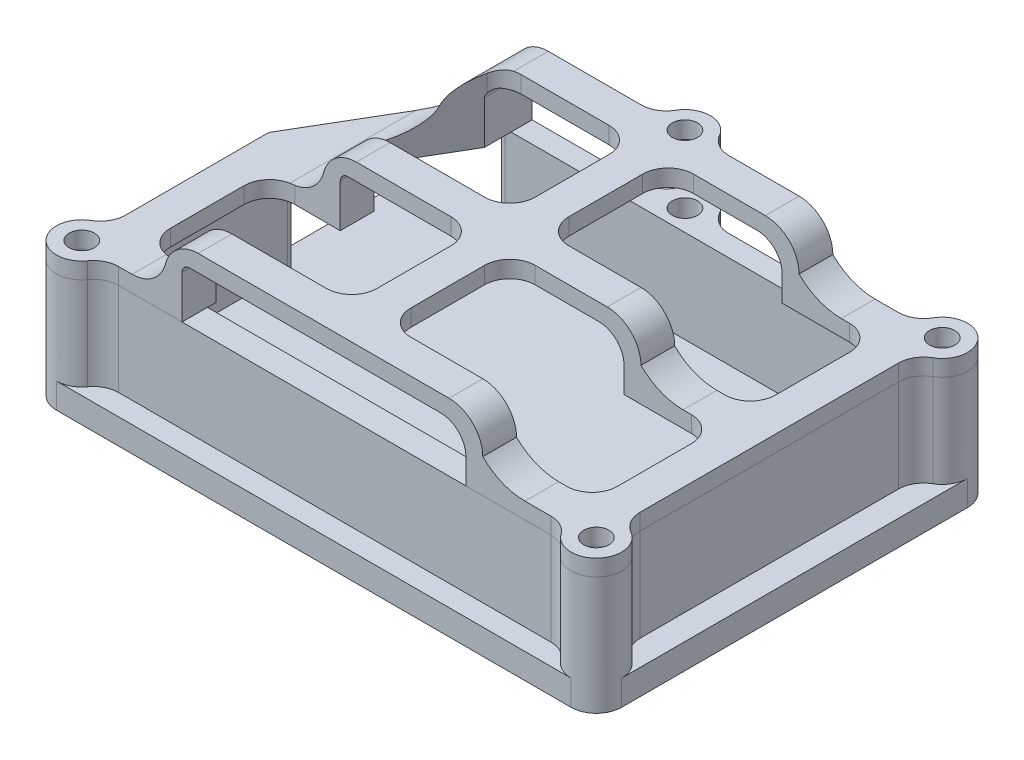
from build123d import *

# Parameters (mm, degrees)
SKETCH5_R           = 1.5
BOSS_EXTRUDE2_DEPTH = 3
SKETCH6_R           = 1.5
BOSS_EXTRUDE3_DEPTH = 11
SKETCH7_R           = 1.5
BOSS_EXTRUDE4_DEPTH = 8
CUT_EXTRUDE1_DEPTH  = 25


with BuildPart() as part:
    # Sketch5 → Boss-Extrude2 (new body)
    with BuildSketch(Plane(origin=(0, 0, 0), x_dir=(1, 0, 0), z_dir=(0, 1, 0))):
        with BuildLine():
            Line((-5.196152423, 20.5), (-27.5, 20.5))
            ThreePointArc((-27.5, 20.5), (-29.621320344, 19.621320344), (-30.5, 17.5))
            Line((-30.5, 17.5), (-30.5, -15.303847577))
            ThreePointArc((-30.5, -15.303847577), (-30.901923789, -16.803847577), (-32, -17.901923789))
            ThreePointArc((-32, -17.901923789), (-33.397777479, -21.276457135), (-30.5, -23.5))
            Line((-30.5, -23.5), (30.5, -23.5))
            ThreePointArc((30.5, -23.5), (32.621320344, -22.621320344), (33.5, -20.5))
            Line((33.5, -20.5), (33.5, 20.5))
            ThreePointArc((33.5, 20.5), (32.621320344, 22.621320344), (30.5, 23.5))
            Line((30.5, 23.5), (0, 23.5))
            ThreePointArc((0, 23.5), (-1.5, 23.098076211), (-2.598076211, 22))
            ThreePointArc((-2.598076211, 22), (-3.696152423, 20.901923789), (-5.196152423, 20.5))
        make_face()
        with Locations(Location((0, 20.5, 0), (0, 0, 270))):
            Circle(SKETCH5_R, mode=Mode.SUBTRACT)
        with Locations(Location((30.5, 20.5, 0), (0, 0, 270))):
            Circle(SKETCH5_R, mode=Mode.SUBTRACT)
        with Locations(Location((30.5, -20.5, 0), (0, 0, 270))):
            Circle(SKETCH5_R, mode=Mode.SUBTRACT)
        with Locations(Location((-30.5, -20.5, 0), (0, 0, 270))):
            Circle(SKETCH5_R, mode=Mode.SUBTRACT)
    extrude(amount=BOSS_EXTRUDE2_DEPTH)

    # Sketch6 → Boss-Extrude3 (add)
    with BuildSketch(Plane(origin=(0, 3, 0), x_dir=(1, 0, 0), z_dir=(0, 1, 0))):
        with BuildLine():
            Line((-30.5, 1.389438463), (-30.5, -15.303847577))
            ThreePointArc((-30.5, -15.303847577), (-30.901923789, -16.803847577), (-32, -17.901923789))
            ThreePointArc((-32, -17.901923789), (-32.723913835, -22.513506209), (-28.063301414, -22.25))
            ThreePointArc((-28.063301414, -22.25), (-26.995909221, -21.330730437), (-25.626602828, -21))
            Line((-25.626602828, -21), (25.626602828, -21))
            ThreePointArc((25.626602828, -21), (26.995909221, -21.330730437), (28.063301414, -22.25))
            ThreePointArc((28.063301414, -22.25), (32.723913835, -22.513506209), (32, -17.901923789))
            ThreePointArc((32, -17.901923789), (30.901923789, -16.803847577), (30.5, -15.303847577))
            Line((30.5, -15.303847577), (30.5, 15.303847577))
            ThreePointArc((30.5, 15.303847577), (30.901923789, 16.803847577), (32, 17.901923789))
            ThreePointArc((32, 17.901923789), (32.621320344, 22.621320344), (27.901923789, 22))
            ThreePointArc((27.901923789, 22), (26.803847577, 20.901923789), (25.303847577, 20.5))
            Line((25.303847577, 20.5), (5.196152423, 20.5))
            ThreePointArc((5.196152423, 20.5), (3.696152423, 20.901923789), (2.598076211, 22))
            ThreePointArc((2.598076211, 22), (0, 23.5), (-2.598076211, 22))
            ThreePointArc((-2.598076211, 22), (-3.696152423, 20.901923789), (-5.196152423, 20.5))
            Line((-5.196152423, 20.5), (-18.854157071, 20.5))
            ThreePointArc((-18.854157071, 20.5), (-19.561263852, 20.207106781), (-19.854157071, 19.5))
            Line((-19.854157071, 19.5), (-19.854157071, 19))
            ThreePointArc((-19.854157071, 19), (-19.561263852, 18.292893219), (-18.854157071, 18))
            Line((-18.854157071, 18), (26, 18))
            ThreePointArc((26, 18), (27.414213562, 17.414213562), (28, 16))
            Line((28, 16), (28, -16))
            ThreePointArc((28, -16), (27.414213562, -17.414213562), (26, -18))
            Line((26, -18), (-26, -18))
            ThreePointArc((-26, -18), (-27.414213562, -17.414213562), (-28, -16))
            Line((-28, -16), (-28, 1.389438463))
            ThreePointArc((-28, 1.389438463), (-28.292893219, 2.096545244), (-29, 2.389438463))
            Line((-29, 2.389438463), (-29.5, 2.389438463))
            ThreePointArc((-29.5, 2.389438463), (-30.207106781, 2.096545244), (-30.5, 1.389438463))
        make_face()
        with Locations(Location((0, 20.5, 0), (0, 0, 270))):
            Circle(SKETCH6_R, mode=Mode.SUBTRACT)
        with Locations(Location((30.5, 20.5, 0), (0, 0, 270))):
            Circle(SKETCH6_R, mode=Mode.SUBTRACT)
        with Locations(Location((30.5, -20.5, 0), (0, 0, 270))):
            Circle(SKETCH6_R, mode=Mode.SUBTRACT)
        with Locations(Location((-30.5, -20.5, 0), (0, 0, 270))):
            Circle(SKETCH6_R, mode=Mode.SUBTRACT)
    extrude(amount=BOSS_EXTRUDE3_DEPTH)


with BuildPart() as body_2:
    # Sketch7 → Boss-Extrude4 (new body)
    with BuildSketch(Plane(origin=(0, 14, 0), x_dir=(1, 0, 0), z_dir=(0, 1, 0))):
        with BuildLine():
            Line((-30.362088709, 1.896195858), (-19.71624578, 20.006757395))
            ThreePointArc((-19.71624578, 20.006757395), (-19.35076688, 20.367973904), (-18.854157071, 20.5))
            Line((-18.854157071, 20.5), (-5.196152423, 20.5))
            ThreePointArc((-5.196152423, 20.5), (-3.696152423, 20.901923789), (-2.598076211, 22))
            ThreePointArc((-2.598076211, 22), (0, 23.5), (2.598076211, 22))
            ThreePointArc((2.598076211, 22), (3.696152423, 20.901923789), (5.196152423, 20.5))
            Line((5.196152423, 20.5), (25.303847577, 20.5))
            ThreePointArc((25.303847577, 20.5), (26.803847577, 20.901923789), (27.901923789, 22))
            ThreePointArc((27.901923789, 22), (32.621320344, 22.621320344), (32, 17.901923789))
            ThreePointArc((32, 17.901923789), (30.901923789, 16.803847577), (30.5, 15.303847577))
            Line((30.5, 15.303847577), (30.5, -15.303847577))
            ThreePointArc((30.5, -15.303847577), (30.901923789, -16.803847577), (32, -17.901923789))
            ThreePointArc((32, -17.901923789), (32.723913835, -22.513506209), (28.063301414, -22.25))
            ThreePointArc((28.063301414, -22.25), (26.995909221, -21.330730437), (25.626602828, -21))
            Line((25.626602828, -21), (-25.626602828, -21))
            ThreePointArc((-25.626602828, -21), (-26.995909221, -21.330730437), (-28.063301414, -22.25))
            ThreePointArc((-28.063301414, -22.25), (-32.723913835, -22.513506209), (-32, -17.901923789))
            ThreePointArc((-32, -17.901923789), (-30.901923789, -16.803847577), (-30.5, -15.303847577))
            Line((-30.5, -15.303847577), (-30.5, 1.389438463))
            ThreePointArc((-30.5, 1.389438463), (-30.464906397, 1.652032532), (-30.362088709, 1.896195858))
        make_face()
        with Locations(Location((0, 20.5, 0), (0, 0, 270))):
            Circle(SKETCH7_R, mode=Mode.SUBTRACT)
        with Locations(Location((30.5, 20.5, 0), (0, 0, 270))):
            Circle(SKETCH7_R, mode=Mode.SUBTRACT)
        with Locations(Location((30.5, -20.5, 0), (0, 0, 270))):
            Circle(SKETCH7_R, mode=Mode.SUBTRACT)
        with Locations(Location((-30.5, -20.5, 0), (0, 0, 270))):
            Circle(SKETCH7_R, mode=Mode.SUBTRACT)
        with BuildLine():
            Line((-26.5, -14), (-26.5, -5.25))
            ThreePointArc((-26.5, -5.25), (-25.621320344, -3.128679656), (-23.5, -2.25))
            Line((-23.5, -2.25), (-5, -2.25))
            ThreePointArc((-5, -2.25), (-2.878679656, -3.128679656), (-2, -5.25))
            Line((-2, -5.25), (-2, -14))
            ThreePointArc((-2, -14), (-2.878679656, -16.121320344), (-5, -17))
            Line((-5, -17), (-23.5, -17))
            ThreePointArc((-23.5, -17), (-25.621320344, -16.121320344), (-26.5, -14))
        make_face(mode=Mode.SUBTRACT)
        with BuildLine():
            Line((-23.151003052, 6.270272185), (-18.007533291, 15.020272185))
            ThreePointArc((-18.007533291, 15.020272185), (-16.91109659, 16.103921711), (-15.421267163, 16.5))
            Line((-15.421267163, 16.5), (-5, 16.5))
            ThreePointArc((-5, 16.5), (-2.878679656, 15.621320344), (-2, 13.5))
            Line((-2, 13.5), (-2, 4.75))
            ThreePointArc((-2, 4.75), (-2.878679656, 2.628679656), (-5, 1.75))
            Line((-5, 1.75), (-20.564736925, 1.75))
            ThreePointArc((-20.564736925, 1.75), (-23.168658636, 3.260170573), (-23.151003052, 6.270272185))
        make_face(mode=Mode.SUBTRACT)
        with BuildLine():
            Line((26.5, 13.5), (26.5, 4.75))
            ThreePointArc((26.5, 4.75), (25.621320344, 2.628679656), (23.5, 1.75))
            Line((23.5, 1.75), (5, 1.75))
            ThreePointArc((5, 1.75), (2.878679656, 2.628679656), (2, 4.75))
            Line((2, 4.75), (2, 13.5))
            ThreePointArc((2, 13.5), (2.878679656, 15.621320344), (5, 16.5))
            Line((5, 16.5), (23.5, 16.5))
            ThreePointArc((23.5, 16.5), (25.621320344, 15.621320344), (26.5, 13.5))
        make_face(mode=Mode.SUBTRACT)
        with BuildLine():
            Line((23.5, -17), (5, -17))
            ThreePointArc((5, -17), (2.878679656, -16.121320344), (2, -14))
            Line((2, -14), (2, -5.25))
            ThreePointArc((2, -5.25), (2.878679656, -3.128679656), (5, -2.25))
            Line((5, -2.25), (23.5, -2.25))
            ThreePointArc((23.5, -2.25), (25.621320344, -3.128679656), (26.5, -5.25))
            Line((26.5, -5.25), (26.5, -14))
            ThreePointArc((26.5, -14), (25.621320344, -16.121320344), (23.5, -17))
        make_face(mode=Mode.SUBTRACT)
    extrude(amount=BOSS_EXTRUDE4_DEPTH)

    # Sketch12 → Cut-Extrude1 (cut, symmetric)
    with BuildSketch(Plane.XY):
        with BuildLine():
            Line((22.535644683, 15.935461725), (33.5, 15.935461725))
            Line((33.5, 15.935461725), (33.5, 22))
            Line((33.5, 22), (13.535903478, 22))
            ThreePointArc((13.535903478, 22), (16.364330602, 20.828427125), (17.535903478, 18))
            ThreePointArc((17.535903478, 18), (19.831031476, 16.471900851), (22.535644683, 15.935461725))
        make_face()
        with BuildLine():
            Line((-18.110253038, 19.097907003), (-18.110253038, 14))
            Line((-18.110253038, 14), (15.535903478, 14))
            Line((15.535903478, 14), (15.535903478, 17))
            ThreePointArc((15.535903478, 17), (14.657223821, 19.121320344), (12.535903478, 20))
            Line((12.535903478, 20), (-17.20816004, 20))
            ThreePointArc((-17.20816004, 20), (-17.846036116, 19.735783078), (-18.110253038, 19.097907003))
        make_face()
        with BuildLine():
            Line((-33.5, 22), (-33.5, 15.935461725))
            Line((-33.5, 15.935461725), (-24.037878933, 15.935461725))
            ThreePointArc((-24.037878933, 15.935461725), (-21.589664269, 16.746671585), (-20.110253038, 18.859290548))
            ThreePointArc((-20.110253038, 18.859290548), (-18.709916629, 21.117463889), (-16.203640726, 22))
            Line((-16.203640726, 22), (-33.5, 22))
        make_face()
    extrude(amount=CUT_EXTRUDE1_DEPTH, both=True, mode=Mode.SUBTRACT)


solid = Compound([part.part, body_2.part])
